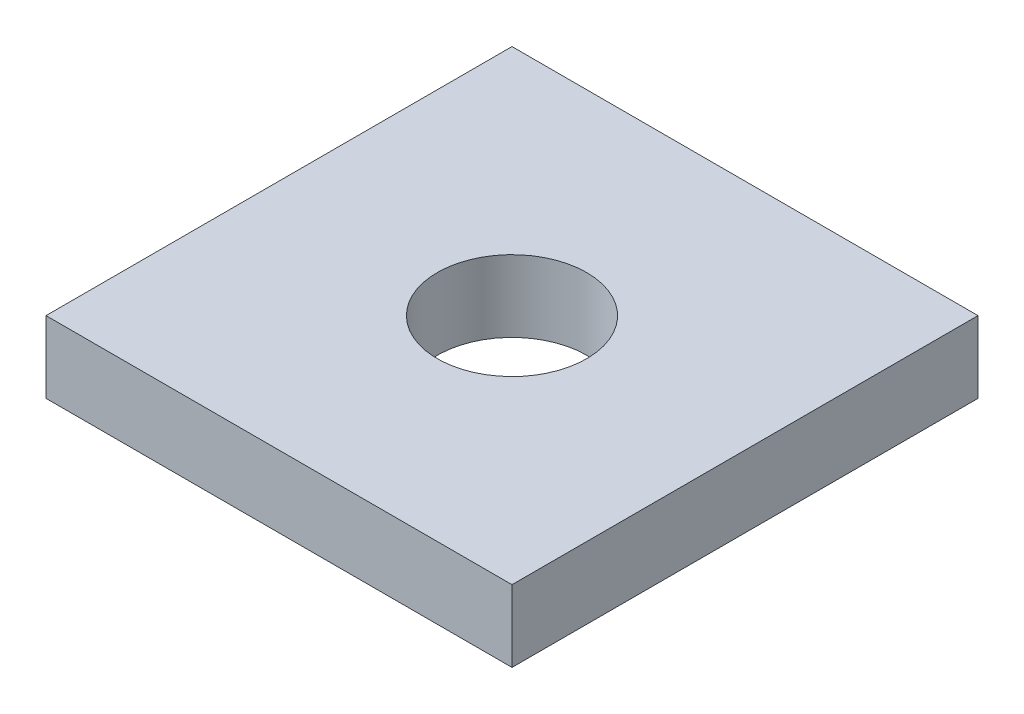
from build123d import *

# Parameters (mm, degrees)
SKETCH2_W           = 39
SKETCH2_H           = 39
BOSS_EXTRUDE2_DEPTH = 6
SKETCH4_R           = 6.25
CUT_EXTRUDE2_DEPTH  = 6


with BuildPart() as part:
    # Sketch2 → Boss-Extrude2 (new body)
    with BuildSketch(Plane(origin=(0, 0, 0), x_dir=(1, 0, 0), z_dir=(0, 1, 0))):
        with Locations((-19.5, -19.5)):
            Rectangle(SKETCH2_W, SKETCH2_H)
    extrude(amount=-BOSS_EXTRUDE2_DEPTH)

    # Sketch4 → Cut-Extrude2 (cut)
    with BuildSketch(Plane.XZ.offset(6)):
        with Locations(Location((-19.5, 19.5, 0), (0, 0, 270))):
            Circle(SKETCH4_R)
    extrude(amount=-CUT_EXTRUDE2_DEPTH, mode=Mode.SUBTRACT)


solid = part.part
